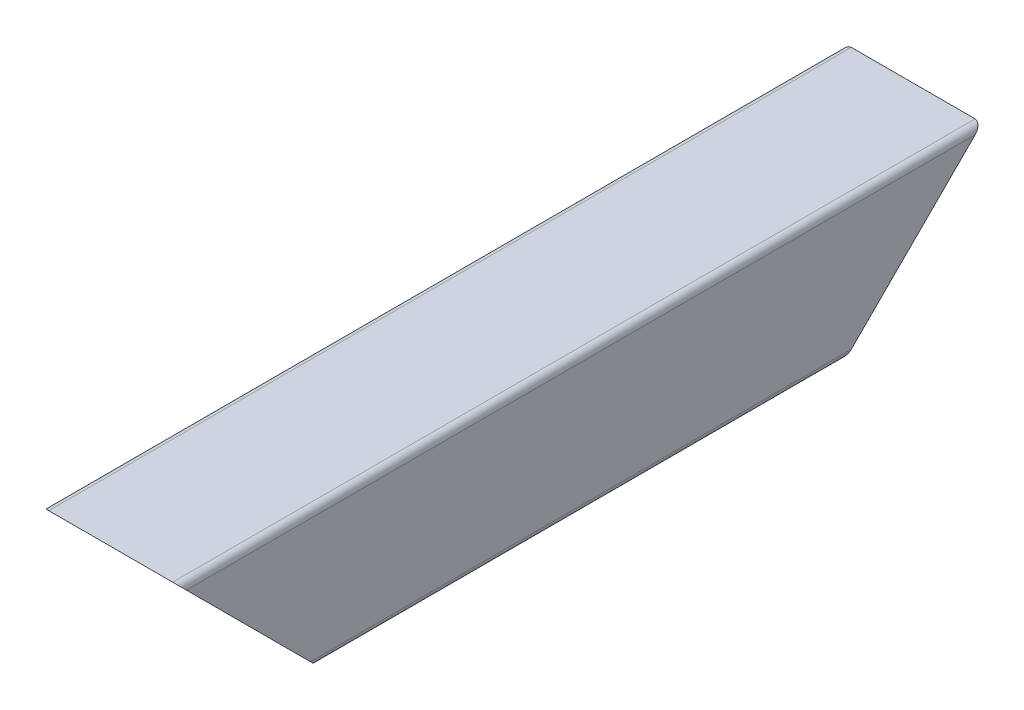
from build123d import *

# Parameters (mm, degrees)
DODANIE_WYCI_GNI_CIE1_DEPTH = 350
SZKIC2_W                    = 140.103855023
SZKIC2_H                    = 128.958798703
WYTNIJ_WYCI_GNI_CIE1_DEPTH  = 297.057426862
SZKIC3_W                    = 180.28107172
SZKIC3_H                    = 138.969006622
WYTNIJ_WYCI_GNI_CIE2_DEPTH  = 327.955654485


with BuildPart() as part:
    # Szkic1 → Dodanie-wyciągnięcie1 (new body)
    with BuildSketch(Plane.XY):
        with BuildLine():
            ThreePointArc((0, 57), (0.878679656, 59.121320344), (3, 60))
            Line((3, 60), (57, 60))
            ThreePointArc((57, 60), (59.121320344, 59.121320344), (60, 57))
            Line((60, 57), (60, 3))
            ThreePointArc((60, 3), (59.121320344, 0.878679656), (57, 0))
            Line((57, 0), (3, 0))
            ThreePointArc((3, 0), (0.878679656, 0.878679656), (0, 3))
            Line((0, 3), (0, 57))
        make_face()
        with BuildLine():
            Line((3, 6), (3, 54))
            ThreePointArc((3, 54), (3.878679656, 56.121320344), (6, 57))
            Line((6, 57), (54, 57))
            ThreePointArc((54, 57), (56.121320344, 56.121320344), (57, 54))
            Line((57, 54), (57, 6))
            ThreePointArc((57, 6), (56.121320344, 3.878679656), (54, 3))
            Line((54, 3), (6, 3))
            ThreePointArc((6, 3), (3.878679656, 3.878679656), (3, 6))
        make_face(mode=Mode.SUBTRACT)
    extrude(amount=DODANIE_WYCI_GNI_CIE1_DEPTH)

    # Szkic2 → Wytnij-wyciągnięcie1 (cut, through all)
    with BuildSketch(Plane(origin=(0, -145, 145), x_dir=(1, 0, 0), z_dir=(0, -0.7071067811865488, 0.7071067811865464))):
        with Locations((39.65073467, 253.465731554)):
            Rectangle(SZKIC2_W, SZKIC2_H)
    extrude(amount=WYTNIJ_WYCI_GNI_CIE1_DEPTH, mode=Mode.SUBTRACT)

    # Szkic3 → Wytnij-wyciągnięcie2 (cut, through all)
    with BuildSketch(Plane(origin=(0, 30, 30), x_dir=(1, 0, 0), z_dir=(0, -0.7071067811865488, -0.7071067811865464))):
        with Locations((27.094402169, -5.623479723)):
            Rectangle(SZKIC3_W, SZKIC3_H)
    extrude(amount=WYTNIJ_WYCI_GNI_CIE2_DEPTH, mode=Mode.SUBTRACT)


solid = part.part
